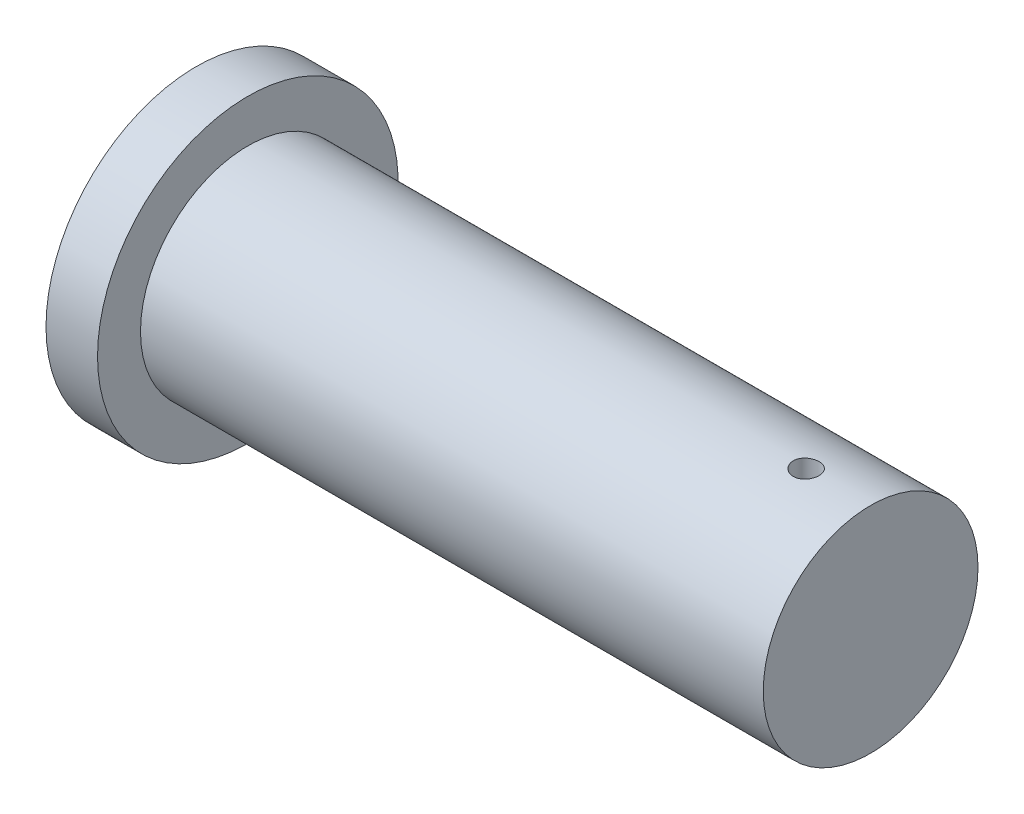
from build123d import *

# Parameters (mm, degrees)
CUT_EXTRUDE3_DEPTH      = 36
CUT_EXTRUDE3_DEPTH_BACK = 165.61773902
SKETCH2_R               = 3


with BuildPart() as part:
    # Sketch1 → Revolve1 (revolve)
    with BuildSketch(Plane.XY):
        Polygon((-157, 0), (0, 0), (0, 25), (-145, 25), (-145, 35), (-157, 35), align=None)
    revolve(axis=Axis((-157, 0, 0), (1, 0, 0)))

    # Sketch2 → Cut-Extrude3 (cut, two sides: drawn at the far end of the back side and taken through both)
    with BuildSketch(Plane(origin=(0, 0, 0), x_dir=(1, 0, 0), z_dir=(0, 1, 0)).offset(-CUT_EXTRUDE3_DEPTH_BACK)):
        with Locations((-15, 0)):
            Circle(SKETCH2_R)
    extrude(amount=CUT_EXTRUDE3_DEPTH + CUT_EXTRUDE3_DEPTH_BACK, mode=Mode.SUBTRACT)


solid = part.part
